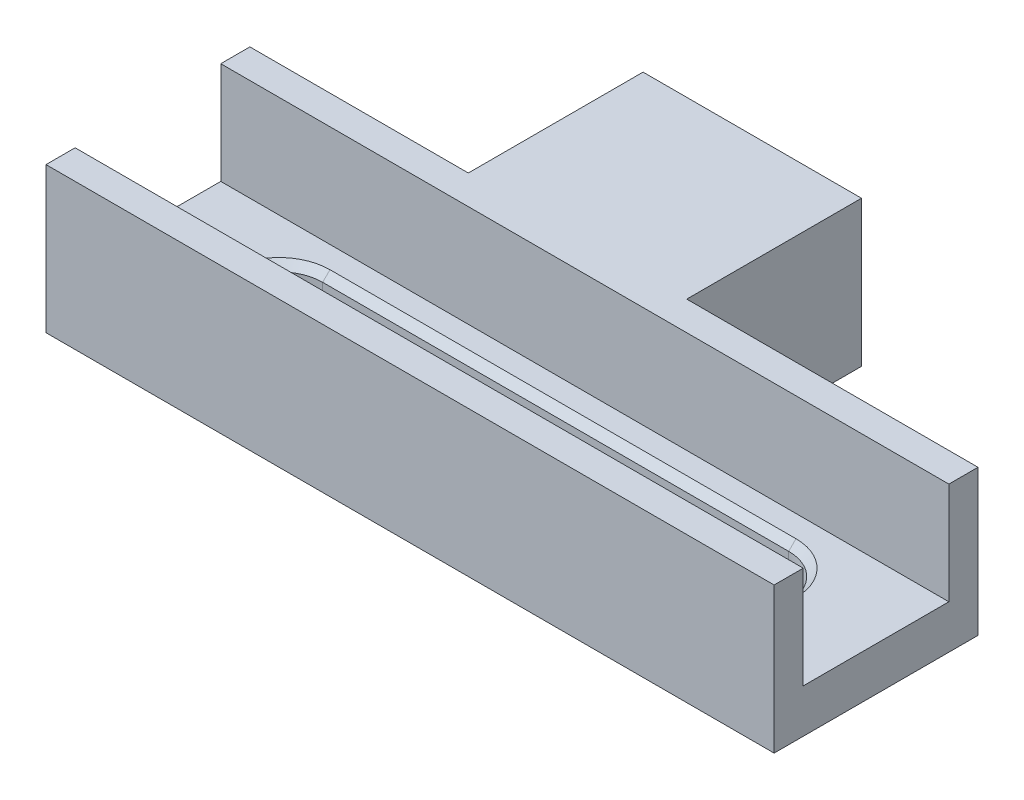
from build123d import *

# Parameters (mm, degrees)
BOSS_EXTRUDE1_DEPTH              = 10
SKETCH2_W                        = 10
SKETCH2_H                        = 7
CUT_EXTRUDE2_DEPTH               = 71
CUT_EXTRUDE3_DEPTH               = 71
F_5_0_19685_DIAMETER_HOLE1_D     = 4.99999
F_5_0_19685_DIAMETER_HOLE1_DEPTH = 10
F_5_0_19685_DIAMETER_HOLE1_TIP   = 1.502148543
CUT_EXTRUDE4_REACH               = 43.061
CUT_EXTRUDE4_END_RADIUS          = 2.499995
SKETCH8_R                        = 2.25
CHAMFER1_SIZE                    = 0.5


with BuildPart() as part:
    # Sketch1 → Boss-Extrude1 (new body)
    with BuildSketch(Plane(origin=(0, 0, 0), x_dir=(1, 0, 0), z_dir=(0, 1, 0))):
        Polygon((-10, 7), (-10, 19), (5, 19), (5, 7), (25, 7), (25, -7), (-25, -7), (-25, 7), align=None)
    extrude(amount=BOSS_EXTRUDE1_DEPTH)

    # Sketch2 → Cut-Extrude2 (cut)
    with BuildSketch(Plane.ZY.offset(25)):
        with Locations((0, 6.5)):
            Rectangle(SKETCH2_W, SKETCH2_H)
    extrude(amount=-CUT_EXTRUDE2_DEPTH, mode=Mode.SUBTRACT)

    # Sketch4 → Cut-Extrude3 (cut)
    with BuildSketch(Plane(origin=(0, 0, 0), x_dir=(1, 0, 0), z_dir=(0, 1, 0))):
        with BuildLine():
            Line((-16, 3), (16, 3))
            ThreePointArc((16, 3), (19, 0), (16, -3))
            Line((16, -3), (-16, -3))
            ThreePointArc((-16, -3), (-19, 0), (-16, 3))
        make_face()
    extrude(amount=CUT_EXTRUDE3_DEPTH, mode=Mode.SUBTRACT)

    # #5 (0.19685) Diameter Hole1
    with Locations(Plane(origin=(0, 0, -19), x_dir=(-1, 0, 0), z_dir=(0, 0, -1))):
        with Locations((0, 5)):
            Hole(F_5_0_19685_DIAMETER_HOLE1_D / 2, depth=F_5_0_19685_DIAMETER_HOLE1_DEPTH)
            with Locations((0, 0, -(F_5_0_19685_DIAMETER_HOLE1_DEPTH + F_5_0_19685_DIAMETER_HOLE1_TIP / 2))):  # 118° drill point
                Cone(0, F_5_0_19685_DIAMETER_HOLE1_D / 2, F_5_0_19685_DIAMETER_HOLE1_TIP, mode=Mode.SUBTRACT)

    # Cut-Extrude4: up to this cylinder (the profile starts outside it)
    cut_extrude4_end = Plane(origin=(0, 5, -13), z_dir=(0, 0, -1)) * Cylinder(CUT_EXTRUDE4_END_RADIUS, 92.12199, mode=Mode.PRIVATE)
    # Sketch8 → Cut-Extrude4 (cut, up to the surface)
    with BuildSketch(Plane.ZY.offset(10), mode=Mode.PRIVATE) as cut_extrude4_sk1:
        with Locations((-13, 5)):
            Circle(SKETCH8_R)
    cut_extrude4_tool1 = extrude(cut_extrude4_sk1.sketch, amount=-CUT_EXTRUDE4_REACH, mode=Mode.PRIVATE) - cut_extrude4_end
    add(cut_extrude4_tool1.solids().sort_by_distance((-10, 5, -13))[0], mode=Mode.SUBTRACT)

    # Chamfer1
    chamfer1_edges = [part.edges().sort_by_distance(p)[0] for p in [
        (0, 3, -3),
        (19, 3, 0),
        (0, 3, 3),
        (-19, 3, 0),
        (-19, 0, 0),
        (0, 0, 3),
        (19, 0, 0),
        (0, 0, -3),
        (-2.499995, 5, -19),
        (-10, 5, -15.25),
    ]]
    chamfer(chamfer1_edges, length=CHAMFER1_SIZE)


solid = part.part
